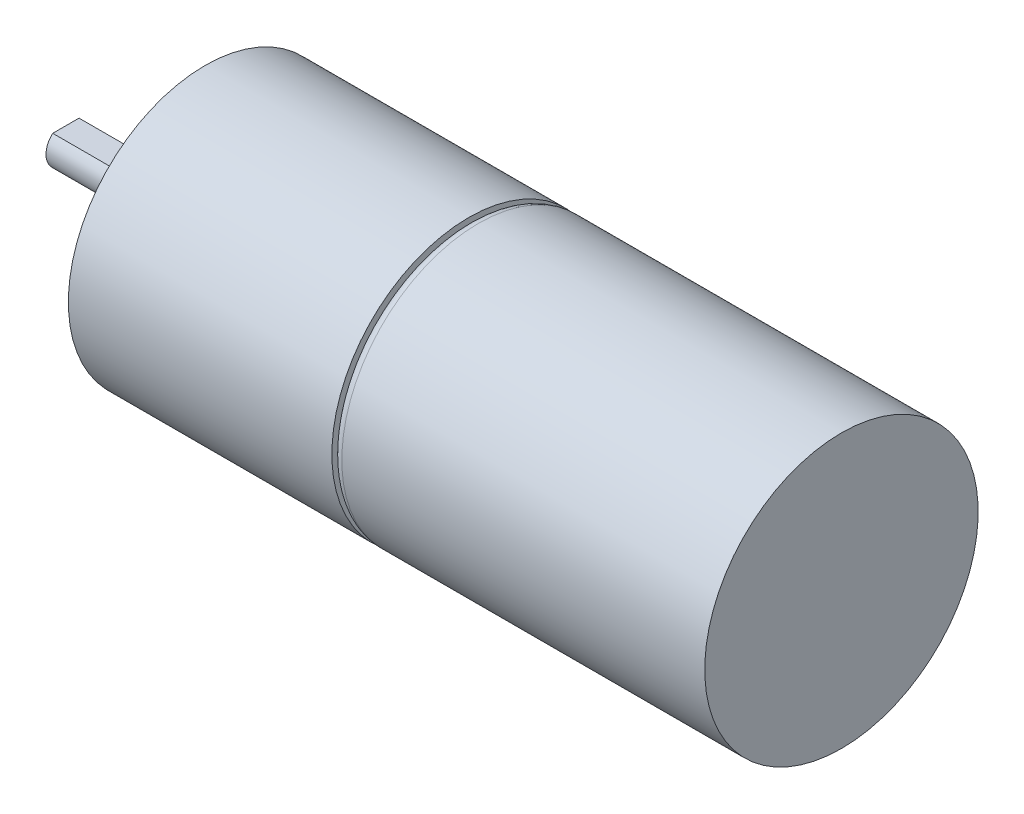
from build123d import *

# Parameters (mm, degrees)
M3_TAPPED_HOLE1_D     = 2.5
M3_TAPPED_HOLE1_DEPTH = 2
M3_TAPPED_HOLE1_TIP   = 0.751075774
CUT_EXTRUDE1_START    = -10
CUT_EXTRUDE1_DEPTH    = 10


with BuildPart() as part:
    # Sketch1 → Revolve1 (revolve)
    with BuildSketch(Plane.XY):
        with BuildLine():
            Line((0, 0), (0, 2))
            Line((0, 2), (12, 2))
            Line((12, 2), (12, 3.5))
            Line((12, 3.5), (14, 3.5))
            Line((14, 3.5), (14, 13.75))
            Line((14, 13.75), (40.5, 13.75))
            Line((40.5, 13.75), (40.5, 12.75))
            ThreePointArc((40.5, 12.75), (40.792893219, 13.457106781), (41.5, 13.75))
            Line((41.5, 13.75), (78, 13.75))
            Line((78, 13.75), (78, 0))
            Line((78, 0), (0, 0))
        make_face()
    revolve(axis=Axis((78, 0, 0), (-1, 0, 0)))

    # M3 Tapped Hole1
    with Locations(Plane(origin=(14, 0, -10), x_dir=(0, -1, 0), z_dir=(-1, 0, 0))):
        with Locations((0, 0), (0, 20)):
            Hole(M3_TAPPED_HOLE1_D / 2, depth=M3_TAPPED_HOLE1_DEPTH)
            with Locations((0, 0, -(M3_TAPPED_HOLE1_DEPTH + M3_TAPPED_HOLE1_TIP / 2))):  # 118° drill point
                Cone(0, M3_TAPPED_HOLE1_D / 2, M3_TAPPED_HOLE1_TIP, mode=Mode.SUBTRACT)

    # Sketch4 → Cut-Extrude1 (cut)
    with BuildSketch(Plane.ZY.offset(CUT_EXTRUDE1_START)):
        with BuildLine():
            Line((-1.322875656, 1.5), (1.322875656, 1.5))
            ThreePointArc((1.322875656, 1.5), (0, 2), (-1.322875656, 1.5))
        make_face()
    extrude(amount=CUT_EXTRUDE1_DEPTH, mode=Mode.SUBTRACT)


solid = part.part
